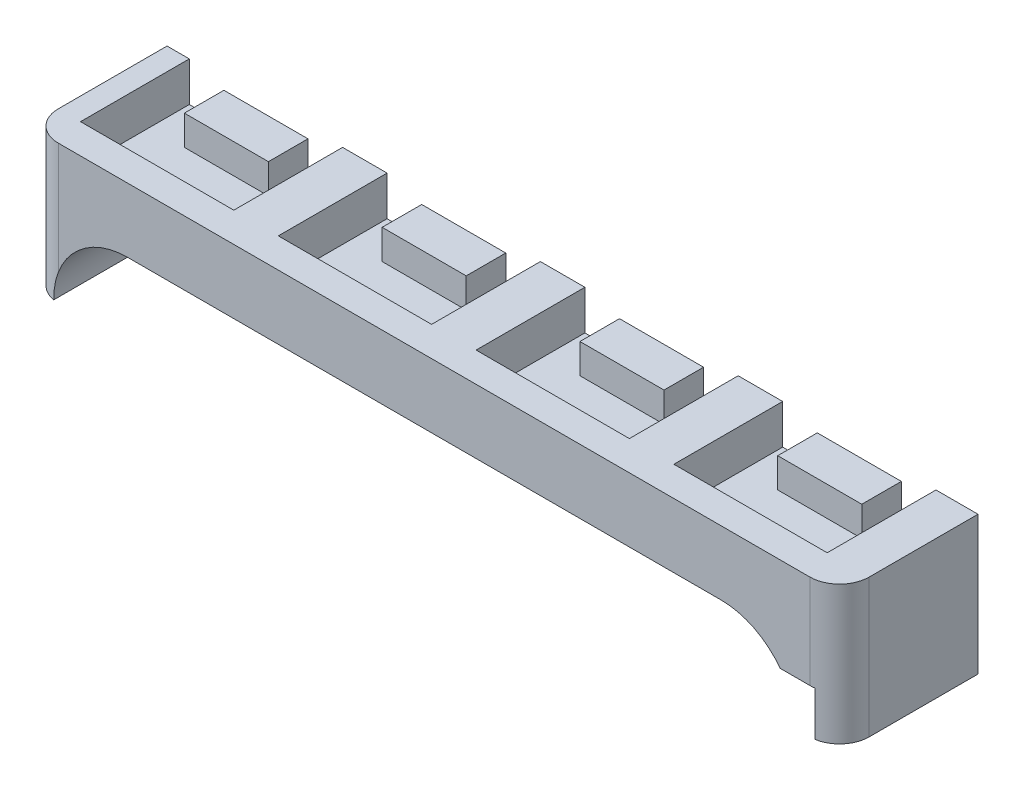
from build123d import *

# Parameters (mm, degrees)
SALIENTE_EXTRUIR1_DEPTH = 14
CROQUIS2_W              = 8.5
CROQUIS2_H              = 3
SALIENTE_EXTRUIR2_DEPTH = 4
SALIENTE_EXTRUIR3_DEPTH = 4
REDONDEO1_R             = 3


with BuildPart() as part:
    # Croquis1 → Saliente-Extruir1 (new body)
    with BuildSketch(Plane.XY):
        with BuildLine():
            Line((-38.5, 7.5), (-41, 7.5))
            Line((-41, 7.5), (-41, 17.5))
            Line((-41, 17.5), (41, 17.5))
            Line((41, 17.5), (41, 7.5))
            Line((41, 7.5), (38.5, 7.5))
            Line((38.5, 7.5), (38.5, 12))
            Line((38.5, 12), (35, 12))
            ThreePointArc((35, 12), (32.354101966, 14.208203932), (29, 15))
            Line((29, 15), (-31, 15))
            ThreePointArc((-31, 15), (-36.303300859, 12.803300859), (-38.5, 7.5))
        make_face()
    extrude(amount=SALIENTE_EXTRUIR1_DEPTH)

    # Croquis2 → Saliente-Extruir2 (add)
    with BuildSketch(Plane.XY):
        with Locations((29, 19)):
            Rectangle(CROQUIS2_W, CROQUIS2_H)
        with Locations((-31, 19)):
            Rectangle(CROQUIS2_W, CROQUIS2_H)
        with Locations((-11, 19)):
            Rectangle(CROQUIS2_W, CROQUIS2_H)
        with Locations((9, 19)):
            Rectangle(CROQUIS2_W, CROQUIS2_H)
    extrude(amount=SALIENTE_EXTRUIR2_DEPTH)

    # Croquis3 → Saliente-Extruir3 (add)
    with BuildSketch(Plane(origin=(0, 17.5, 0), x_dir=(1, 0, 0), z_dir=(0, 1, 0))):
        Polygon((-41, -14), (41, -14), (41, 0), (36.75, 0), (36.75, -11), (21.25, -11), (21.25, 0), (16.75, 0), (16.75, -11), (1.25, -11), (1.25, 0), (-3.25, 0), (-3.25, -11), (-18.75, -11), (-18.75, 0), (-23.25, 0), (-23.25, -11), (-38.75, -11), (-38.75, 0), (-41, 0), align=None)
    extrude(amount=SALIENTE_EXTRUIR3_DEPTH)

    # Redondeo1
    redondeo1_edges = [part.edges().sort_by_distance(p)[0] for p in [
        (-41, 14.5, 14),
        (41, 14.5, 14),
    ]]
    fillet(redondeo1_edges, radius=REDONDEO1_R)


solid = part.part
